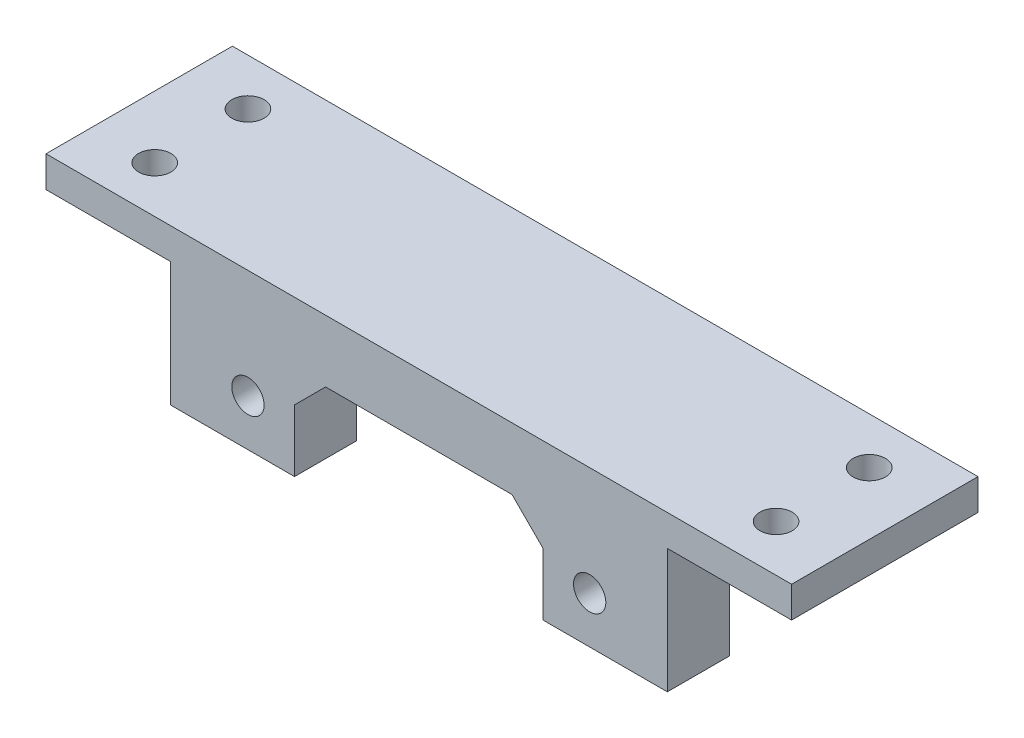
from build123d import *

# Parameters (mm, degrees)
EXTRUDE_1_DEPTH     = 30
CHAMFER_2_SIZE      = 5
SKETCH_2_R          = 2.6
CUT_EXTRUDE_1_DEPTH = 127.194294641
SKETCH_3_W          = 10
SKETCH_3_H          = 15
CUT_EXTRUDE_2_DEPTH = 107.301458127
SKETCH_4_R          = 2.6
CUT_EXTRUDE_3_DEPTH = 126.299640861


with BuildPart() as part:
    # 草图1 → 凸台-拉伸1 (new body)
    with BuildSketch(Plane.XY):
        Polygon((20, 0), (20, -20), (40, -20), (40, -5), (80, -5), (80, -20), (100, -20), (100, 0), (120, 0), (120, 5), (0, 5), (0, 0), align=None)
    extrude(amount=EXTRUDE_1_DEPTH)

    # 倒角2
    chamfer_2_edges = [part.edges().sort_by_distance(p)[0] for p in [
        (80, -5, 15),
        (40, -5, 15),
    ]]
    chamfer(chamfer_2_edges, length=CHAMFER_2_SIZE)

    # 草图2 → 切除-拉伸1 (cut, through all)
    with BuildSketch(Plane(origin=(0, 5, 0), x_dir=(1, 0, 0), z_dir=(0, 1, 0))):
        with Locations(Location((10, -7.5, 0), (0, 0, 270))):
            Circle(SKETCH_2_R)
        with Locations(Location((10, -22.5, 0), (0, 0, 270))):
            Circle(SKETCH_2_R)
        with Locations(Location((110, -22.5, 0), (0, 0, 270))):
            Circle(SKETCH_2_R)
        with Locations(Location((110, -7.5, 0), (0, 0, 270))):
            Circle(SKETCH_2_R)
    extrude(amount=-CUT_EXTRUDE_1_DEPTH, mode=Mode.SUBTRACT)

    # 草图3 → 切除-拉伸2 (cut, through all)
    with BuildSketch(Plane.ZY.offset(-20)):
        with Locations((15, -12.5)):
            Rectangle(SKETCH_3_W, SKETCH_3_H)
    extrude(amount=-CUT_EXTRUDE_2_DEPTH, mode=Mode.SUBTRACT)

    # 草图4 → 切除-拉伸3 (cut, through all)
    with BuildSketch(Plane(origin=(0, 0, 0), x_dir=(-1, 0, 0), z_dir=(0, 0, -1))):
        with Locations((-87.5, -12.5)):
            Circle(SKETCH_4_R)
        with Locations((-32.5, -12.5)):
            Circle(SKETCH_4_R)
    extrude(amount=-CUT_EXTRUDE_3_DEPTH, mode=Mode.SUBTRACT)


solid = part.part
